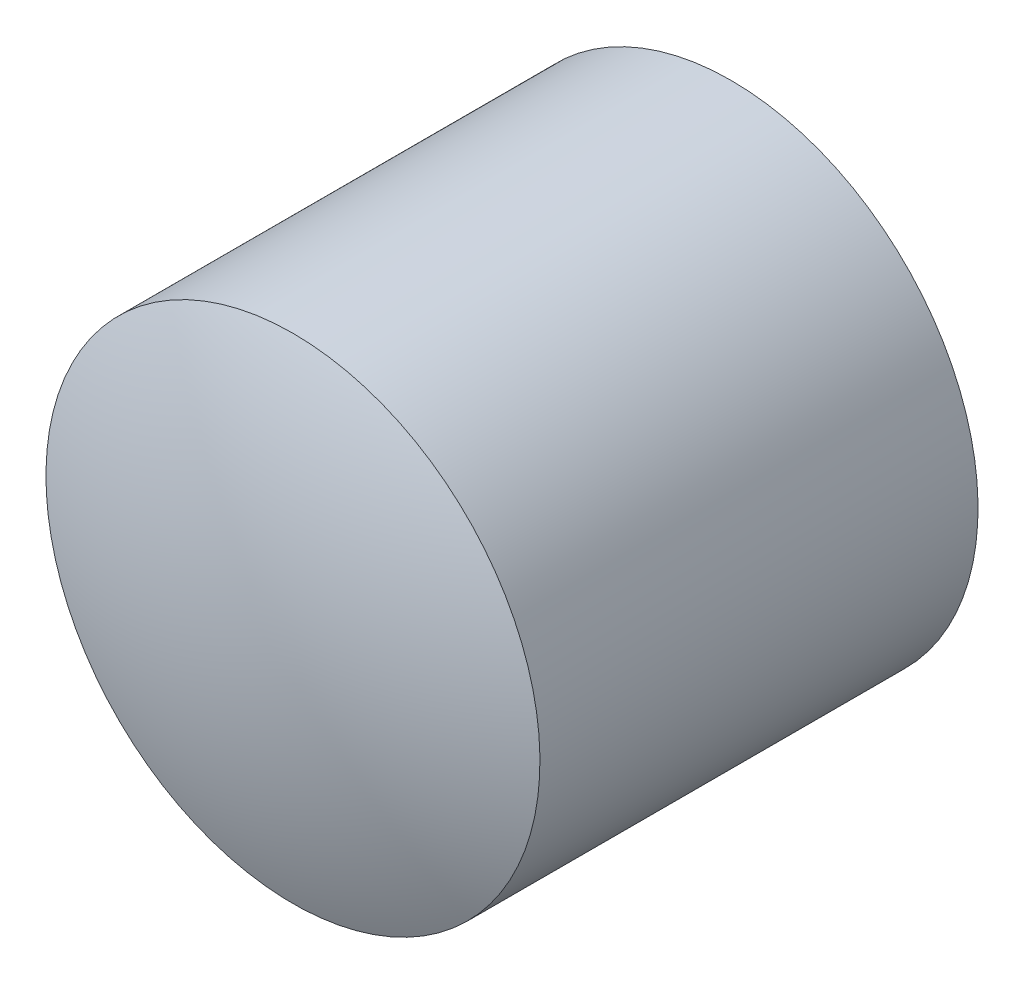
from build123d import *


with BuildPart() as part:
    # Sketch3 → Revolve1 (revolve)
    with BuildSketch(Plane(origin=(0, 0, 0), x_dir=(0, 0, -1), z_dir=(1, 0, 0))):
        with BuildLine():
            Line((-6.872852234, 0), (0, 0))
            ThreePointArc((0, 0), (0.197271545, 1.976490534), (0.781302966, 3.875))
            Line((0.781302966, 3.875), (-6.091549267, 3.875))
            ThreePointArc((-6.091549267, 3.875), (-6.675580689, 1.976490534), (-6.872852234, 0))
        make_face()
    revolve(axis=Axis((0, 0, 0), (0, 0, 1)))


solid = part.part
